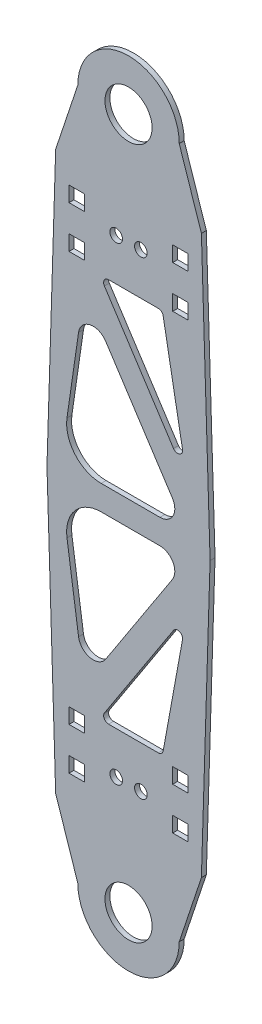
from build123d import *

# Parameters (mm, degrees)
SKETCH_1_R      = 9.55
SKETCH_1_R_2    = 2.55
SKETCH_1_W      = 6.2
SKETCH_1_H      = 6.2
EXTRUDE_2_DEPTH = 2
FILLET_1_R      = 6
FILLET_2_R      = 14
FILLET_3_R      = 2


with BuildPart() as part:
    # 草图1 → 凸台-拉伸2 (new body)
    with BuildSketch(Plane.XY):
        with BuildLine():
            Line((-17.779440223, 210.011697354), (-26.761097666, 183.008415033))
            Line((-26.761097666, 183.008415033), (-30.283015797, 70.011697354))
            Line((-30.283015797, 70.011697354), (-26.761097666, -42.985020326))
            Line((-26.761097666, -42.985020326), (-17.779440223, -69.988302646))
            ThreePointArc((-17.779440223, -69.988302646), (2.748608262, -90.516351131), (23.276656746, -69.988302646))
            Line((23.276656746, -69.988302646), (32.258314189, -42.985020326))
            Line((32.258314189, -42.985020326), (35.78023232, 70.011697354))
            Line((35.78023232, 70.011697354), (32.258314189, 183.008415033))
            Line((32.258314189, 183.008415033), (23.276656746, 210.011697354))
            ThreePointArc((23.276656746, 210.011697354), (2.748608262, 230.539745838), (-17.779440223, 210.011697354))
        make_face()
        with Locations((2.748608262, 210.011697354)):
            Circle(SKETCH_1_R, mode=Mode.SUBTRACT)
        with Locations((-2.251391738, 165.011697354)):
            Circle(SKETCH_1_R_2, mode=Mode.SUBTRACT)
        with Locations((7.748608262, 165.011697354)):
            Circle(SKETCH_1_R_2, mode=Mode.SUBTRACT)
        with Locations((7.748608262, -24.988302646)):
            Circle(SKETCH_1_R_2, mode=Mode.SUBTRACT)
        with Locations((-2.251391738, -24.988302646)):
            Circle(SKETCH_1_R_2, mode=Mode.SUBTRACT)
        with Locations((2.748608262, -69.988302646)):
            Circle(SKETCH_1_R, mode=Mode.SUBTRACT)
        with Locations((-18.251391738, 152.961697354)):
            Rectangle(SKETCH_1_W, SKETCH_1_H, mode=Mode.SUBTRACT)
        with Locations((-18.251391738, 170.061697354)):
            Rectangle(SKETCH_1_W, SKETCH_1_H, mode=Mode.SUBTRACT)
        Polygon((26.399526511, 93.573959612), (-9.02733062, 147.961697354), (16.478190756, 147.961697354), align=None, mode=Mode.SUBTRACT)
        Polygon((-15.205972232, 139.125442928), (-24.505459679, 75.011697354), (26.556171202, 75.011697354), align=None, mode=Mode.SUBTRACT)
        with Locations((23.748608262, 152.961697354)):
            Rectangle(SKETCH_1_W, SKETCH_1_H, mode=Mode.SUBTRACT)
        with Locations((23.748608262, 170.061697354)):
            Rectangle(SKETCH_1_W, SKETCH_1_H, mode=Mode.SUBTRACT)
        with Locations((23.748608262, -30.038302646)):
            Rectangle(SKETCH_1_W, SKETCH_1_H, mode=Mode.SUBTRACT)
        with Locations((23.748608262, -12.938302646)):
            Rectangle(SKETCH_1_W, SKETCH_1_H, mode=Mode.SUBTRACT)
        with Locations((-18.251391738, -12.938302646)):
            Rectangle(SKETCH_1_W, SKETCH_1_H, mode=Mode.SUBTRACT)
        Polygon((26.556171202, 65.011697354), (-15.205972232, 0.897951779), (-24.505459679, 65.011697354), align=None, mode=Mode.SUBTRACT)
        Polygon((16.478190756, -7.938302646), (26.399526511, 46.449435095), (-9.02733062, -7.938302646), align=None, mode=Mode.SUBTRACT)
        with Locations((-18.251391738, -30.038302646)):
            Rectangle(SKETCH_1_W, SKETCH_1_H, mode=Mode.SUBTRACT)
    extrude(amount=EXTRUDE_2_DEPTH)

    # 圆角1
    fillet_1_edges = [part.edges().sort_by_distance(p)[0] for p in [
        (-15.205972232, 139.125442928, 1),
        (26.556171202, 75.011697354, 1),
        (26.556171202, 65.011697354, 1),
        (-15.205972232, 0.897951779, 1),
    ]]
    fillet(fillet_1_edges, radius=FILLET_1_R)

    # 圆角2
    fillet_2_edges = [part.edges().sort_by_distance(p)[0] for p in [
        (-24.505459679, 75.011697354, 1),
        (-24.505459679, 65.011697354, 1),
    ]]
    fillet(fillet_2_edges, radius=FILLET_2_R)

    # 圆角3
    fillet_3_edges = [part.edges().sort_by_distance(p)[0] for p in [
        (-9.02733062, -7.938302646, 1),
        (16.478190756, -7.938302646, 1),
        (26.399526511, 46.449435095, 1),
        (-9.02733062, 147.961697354, 1),
        (26.399526511, 93.573959612, 1),
        (16.478190756, 147.961697354, 1),
    ]]
    fillet(fillet_3_edges, radius=FILLET_3_R)


solid = part.part
